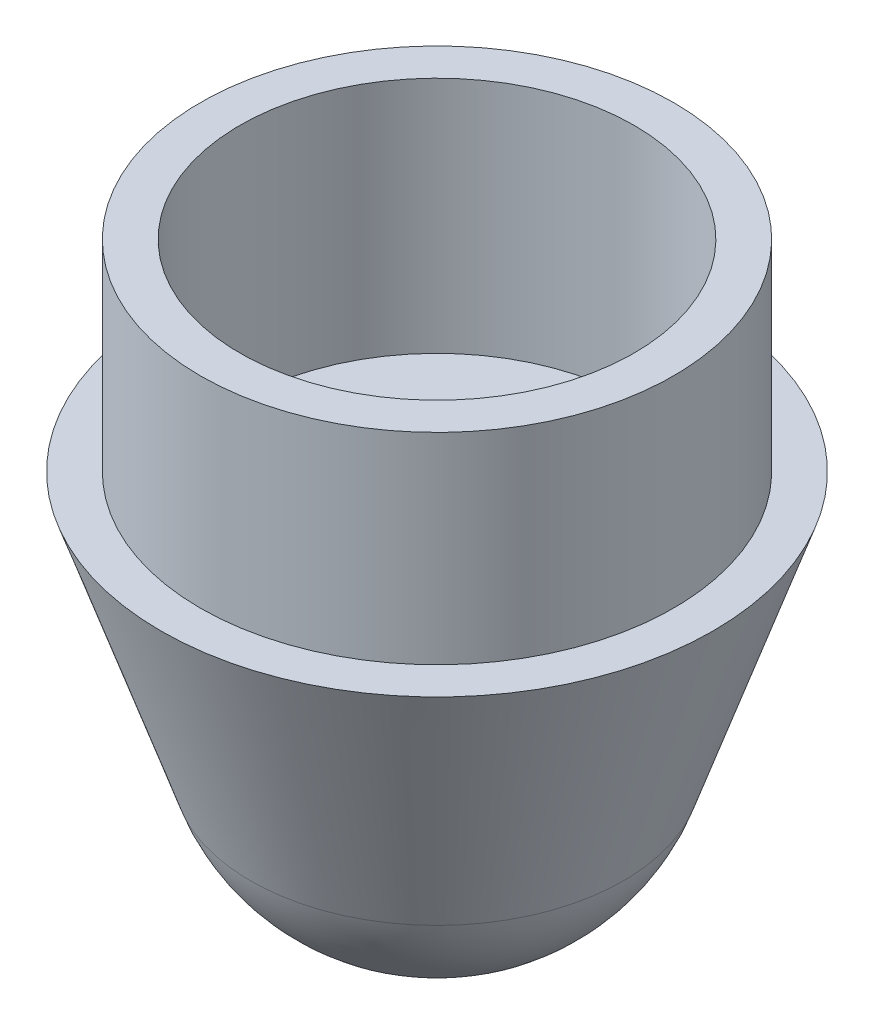
from build123d import *


with BuildPart() as part:
    # Esquisse1 → Révolution1 (revolve)
    with BuildSketch(Plane.XY, mode=Mode.PRIVATE) as r_volution1_sk:
        with BuildLine():
            Line((-10, 0), (-10, 12.083333333))
            Line((-10, 12.083333333), (-12, 12.083333333))
            Line((-12, 12.083333333), (-12, 1.880668734))
            Line((-12, 1.880668734), (-14, 1.880668734))
            Line((-14, 1.880668734), (-9.459459459, -11.362574509))
            ThreePointArc((-9.459459459, -11.362574509), (-5.812381937, -16.256665978), (0, -18.119331266))
            Line((0, -18.119331266), (0, 0))
            Line((0, 0), (-10, 0))
        make_face()
    revolve(r_volution1_sk.sketch.rotate(Axis((0, 0, 0), (0, 1, 0)), 270), axis=Axis((0, 0, 0), (0, 1, 0)))


solid = part.part
